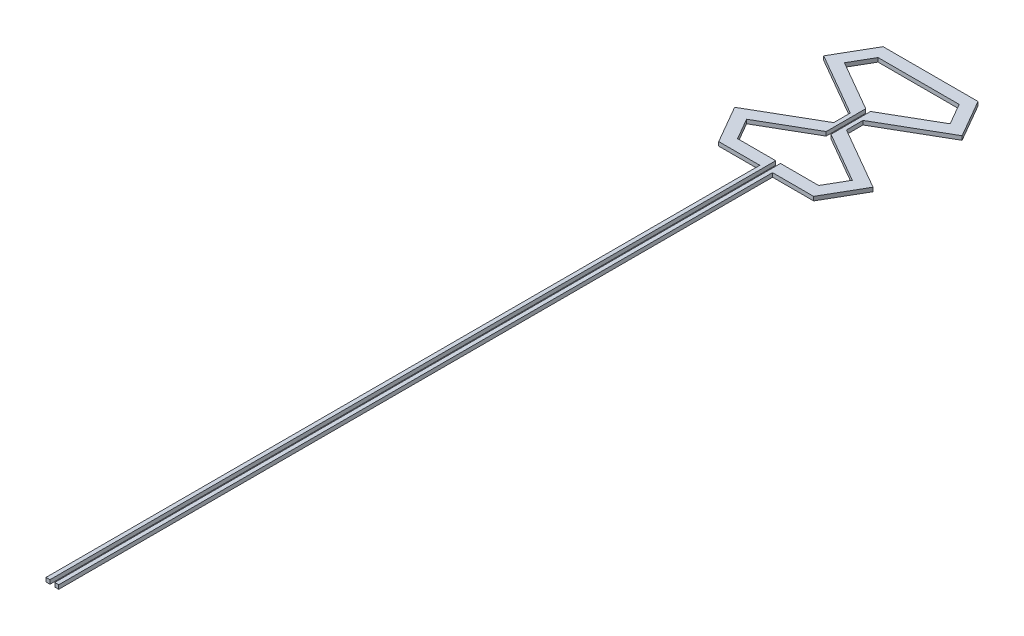
from build123d import *

# Parameters (mm, degrees)
EXTRUDE_1_DEPTH          = 1
EXTRUDE_1_2_DEPTH        = 1
CUT_EXTRUDE_1_DEPTH      = 2
CUT_EXTRUDE_1_DEPTH_BACK = 2
SKETCH_2_W               = 1.200484238
SKETCH_2_H               = 35
SKETCH_3_W               = 1
SKETCH_3_H               = 179.349364905
EXTRUDE_2_DEPTH          = 1


with BuildPart() as part:
    # 草图1 → 凸台-拉伸1 (new body)
    with BuildSketch(Plane(origin=(0, 0, 0), x_dir=(1, 0, 0), z_dir=(0, 1, 0))):
        Polygon((11.922649731, 20.650635095), (-11.922649731, 20.650635095), (-17.383974596, 11.191342951), (0, 1.154700538), (17.383974596, 11.191342951), align=None)
        Polygon((10.190598923, 17.650635095), (-10.190598923, 17.650635095), (-13.285898385, 12.289419162), (0, 4.618802154), (13.285898385, 12.289419162), align=None, mode=Mode.SUBTRACT)
    extrude(amount=EXTRUDE_1_DEPTH)


with BuildPart() as body_2:
    # 草图1 → Extrude 1 2 (new body)
    with BuildSketch(Plane(origin=(0, 0, 0), x_dir=(1, 0, 0), z_dir=(0, 1, 0))):
        Polygon((0, -1.154700538), (-17.383974596, -11.191342951), (-11.922649731, -20.650635095), (11.922649731, -20.650635095), (17.383974596, -11.191342951), align=None)
        Polygon((0, -4.618802154), (-13.285898385, -12.289419162), (-10.190598923, -17.650635095), (10.190598923, -17.650635095), (13.285898385, -12.289419162), align=None, mode=Mode.SUBTRACT)
    extrude(amount=EXTRUDE_1_2_DEPTH)


with BuildPart() as cut_extrude_1_tool:
    # 草图2 → 切除-拉伸1 (new, two sides: drawn at the far end of the back side and taken through both)
    with BuildSketch(Plane(origin=(0, 0, 0), x_dir=(1, 0, 0), z_dir=(0, 1, 0)).offset(-CUT_EXTRUDE_1_DEPTH_BACK)):
        with Locations((0, -4.618802154)):
            Rectangle(SKETCH_2_W, SKETCH_2_H)
    extrude(amount=CUT_EXTRUDE_1_DEPTH + CUT_EXTRUDE_1_DEPTH_BACK)


with BuildPart() as part_1:
    add(part.part)

    # 切除-拉伸1: cut by cut_extrude_1_tool
    add(cut_extrude_1_tool.part, mode=Mode.SUBTRACT)



with BuildPart() as body_2_1:
    add(body_2.part)

    # 切除-拉伸1: cut by cut_extrude_1_tool
    add(cut_extrude_1_tool.part, mode=Mode.SUBTRACT)


with BuildPart() as part_2:
    add(part_1.part)

    add(body_2_1.part)  # 凸台-拉伸2 merges body 2
    # 草图3 → 凸台-拉伸2 (add)
    with BuildSketch(Plane(origin=(0, 0, 0), x_dir=(1, 0, 0), z_dir=(0, 1, 0))):
        with Locations((-1.100242119, -110.325317548)):
            Rectangle(SKETCH_3_W, SKETCH_3_H)
        with Locations((1.100242119, -110.325317548)):
            Rectangle(SKETCH_3_W, SKETCH_3_H)
        Polygon((-0.600242119, -1.501250487), (-0.600242119, 1.501250487), (-1.600242119, 2.078600756), (-1.600242119, -2.078600756), align=None)
        Polygon((0.600242119, -1.501250487), (0.600242119, 1.501250487), (1.600242119, 2.078600756), (1.600242119, -2.078600756), align=None)
    extrude(amount=EXTRUDE_2_DEPTH)


solid = part_2.part
